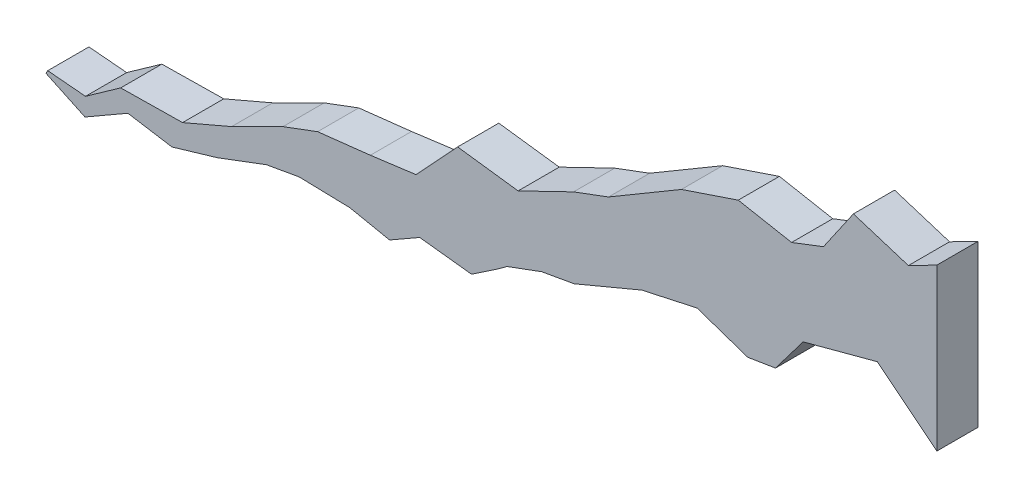
from build123d import *

# Parameters (mm, degrees)
AUFSATZ_LINEAR_AUSTRAGEN1_DEPTH = 3


with BuildPart() as part:
    # Model → Aufsatz-Linear austragen1 (new body)
    with BuildSketch(Plane.XY):
        Polygon((65.064121, 21.807638525), (62.991032211, 20.74255457), (58.984084126, 22.00272439), (56.803026288, 18.838800991), (54.47947364, 17.944388553), (50.590045168, 18.671312469), (46.453572189, 17.279002848), (41.134110077, 14.142873543), (38.589728344, 13.192799771), (34.5476256, 11.233834156), (30.138450774, 11.805962104), (27.107969747, 8.540929476), (23.780046409, 8.100068659), (19.936127337, 7.664785218), (17.41204954, 6.721746516), (13.666478399, 4.851440527), (10.094159276, 3.31838703), (5.581557396, 3.252404134), (3.018679888, 1.437790494), (0.267615815, 1.681687606), (0.139255665, 1.450037519), (2.981259215, 0.112718703), (6.103803639, 1.911841244), (9.316252445, 1.390545324), (12.654979952, 2.375260761), (16.2205293, 3.716688419), (18.59217244, 4.136227412), (22.278782524, 4.040377998), (25.178549561, 3.451362989), (27.378100316, 4.707930745), (31.154159786, 4.275156188), (33.120124598, 5.602792152), (33.743945474, 6.05917628), (36.273485131, 6.993163334), (38.623931318, 7.409502482), (43.568119128, 9.480736692), (47.587851937, 10.360104548), (51.289746217, 9.100216289), (53.306429565, 9.430364623), (55.321012546, 12.093179433), (60.7300212, 13.5422604), (65.064121, 10.068977561), align=None)
    extrude(amount=AUFSATZ_LINEAR_AUSTRAGEN1_DEPTH)


solid = part.part
